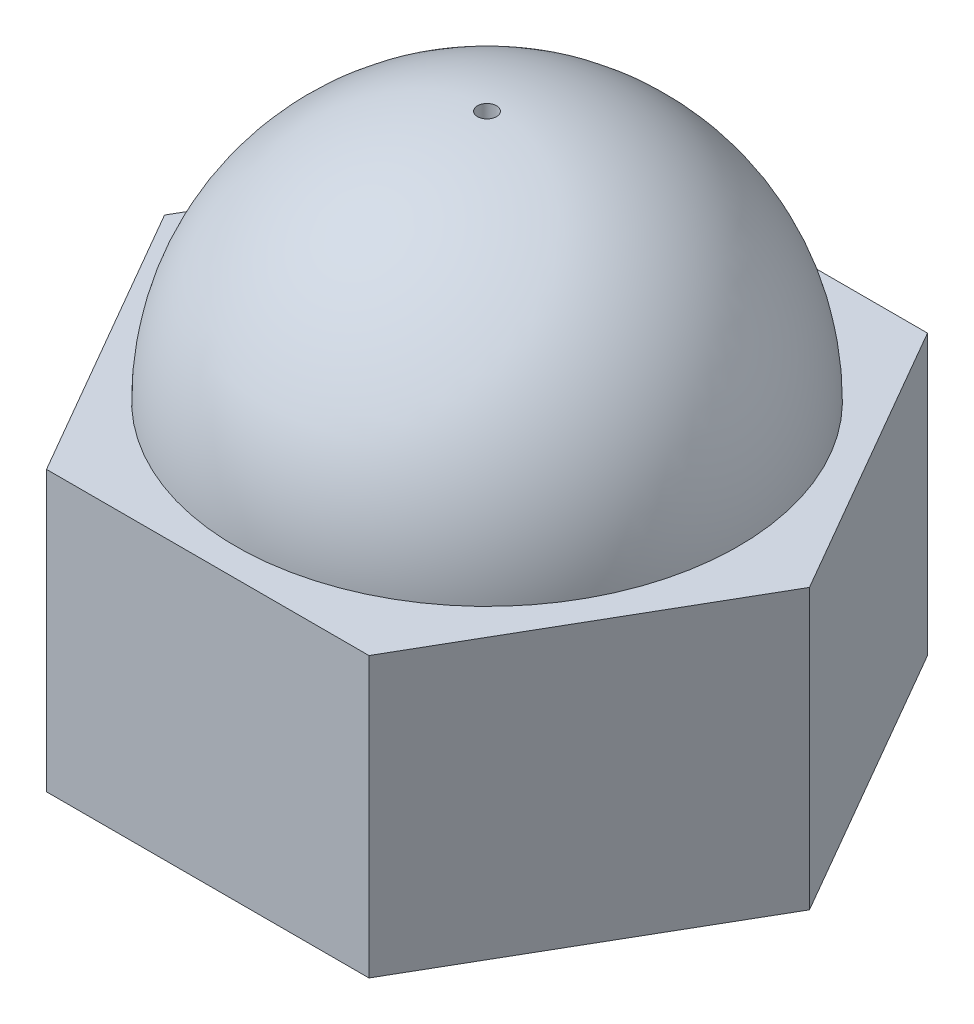
from build123d import *

# Parameters (mm, degrees)
BOSS_EXTRUDE1_DEPTH = 5
SKETCH4_R           = 3
CUT_EXTRUDE1_DEPTH  = 5
SKETCH6_R           = 0.17
CUT_EXTRUDE2_DEPTH  = 10.128709292
CHAMFER2_SIZE       = 0.875
CHAMFER2_SIZE2      = 2


with BuildPart() as part:
    # Sketch1 → Boss-Extrude1 (new body)
    with BuildSketch(Plane(origin=(0, 0, 0), x_dir=(1, 0, 0), z_dir=(0, 1, 0))):
        Polygon((5.773502692, 0), (2.886751346, 5), (-2.886751346, 5), (-5.773502692, 0), (-2.886751346, -5), (2.886751346, -5), align=None)
    extrude(amount=BOSS_EXTRUDE1_DEPTH)

    # Sketch3 → Revolve1 (revolve)
    with BuildSketch(Plane.XY):
        with BuildLine():
            Line((0, 5), (-4.5, 5))
            ThreePointArc((-4.5, 5), (-3.181980515, 8.181980515), (0, 9.5))
            Line((0, 9.5), (0, 5))
        make_face()
    revolve(axis=Axis((0, 0, 0), (0, 1, 0)))

    # Sketch4 → Cut-Extrude1 (cut)
    with BuildSketch(Plane.XZ):
        with Locations(Location((0, 0, 0), (0, 0, 270))):
            Circle(SKETCH4_R)
    extrude(amount=-CUT_EXTRUDE1_DEPTH, mode=Mode.SUBTRACT)

    # Sketch6 → Cut-Extrude2 (cut, through all)
    with BuildSketch(Plane.XZ.offset(-5)):
        with Locations(Location((0, 0, 0), (0, 0, 270))):
            Circle(SKETCH6_R)
    extrude(amount=-CUT_EXTRUDE2_DEPTH, mode=Mode.SUBTRACT)

    # Chamfer2
    chamfer2_edges = [part.edges().sort_by_distance(p)[0] for p in [
        (0, 5, 0.17),
    ]]
    chamfer2_side = [part.faces().sort_by_distance(p)[0] for p in [
        (0, 5, 2.915147186),
    ]]
    chamfer(chamfer2_edges, length=CHAMFER2_SIZE, length2=CHAMFER2_SIZE2, reference=chamfer2_side[0])


solid = part.part
